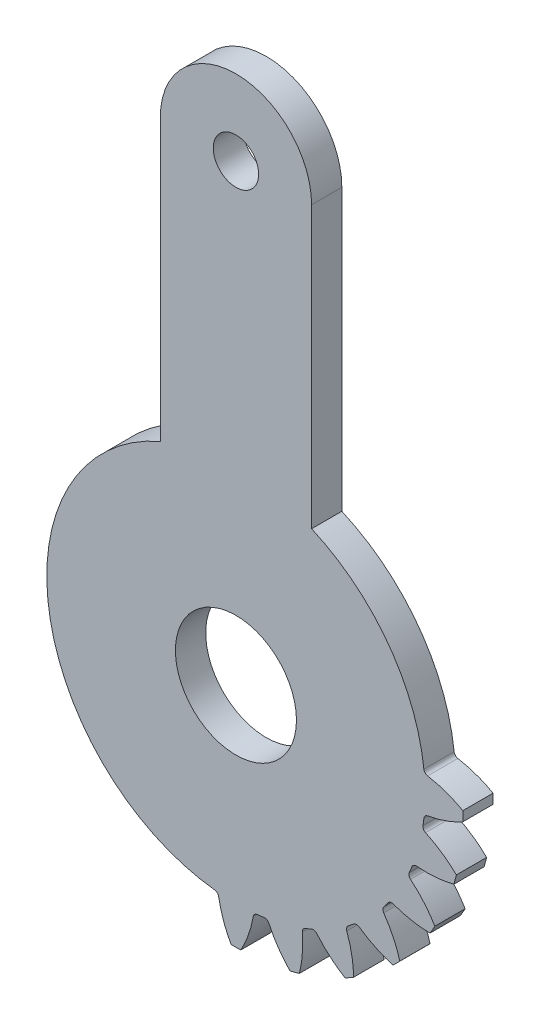
from build123d import *

# Parameters (mm, degrees)
SKETCH_1_R                       = 1.5
SKETCH_1_R_2                     = 4
EXTRUDE_2_DEPTH                  = 2
EXTRUDE_3_DEPTH                  = 2
FILLET_1_R                       = 0.3
PATTERN_CIRCULAR_1_COUNT         = 7
PATTERN_CIRCULAR_1_ANGLE         = 90
FILLET_1_OF_PATTERN_CIRCULAR_1_R = 0.3


with BuildPart() as part:
    # 스케치1 → 보스-돌출2 (new body)
    # profile 1 of 2: a face of its own
    with BuildSketch(Plane.XY):
        with BuildLine():
            ThreePointArc((5, 30), (0, 35), (-5, 30))
            Line((-5, 30), (-5, 16.248076809))
            ThreePointArc((-5, 16.248076809), (0, 17), (5, 16.248076809))
            Line((5, 16.248076809), (5, 30))
        make_face()
        with Locations((0, 30)):
            Circle(SKETCH_1_R, mode=Mode.SUBTRACT)
    # profile 2 of 2: a face of its own
    with BuildSketch(Plane.XY):
        with BuildLine():
            ThreePointArc((5, 16.248076809), (0, 17), (-5, 16.248076809))
            Line((-5, 16.248076809), (-5, 11.456439237))
            ThreePointArc((-5, 11.456439237), (-12.406213217, -1.528356511), (-2.07, -12.327412543))
            ThreePointArc((-2.07, -12.327412543), (0, -12.5), (2.07, -12.327412543))
            ThreePointArc((2.07, -12.327412543), (12.406213217, -1.528356511), (5, 11.456439237))
            Line((5, 11.456439237), (5, 16.248076809))
        make_face()
        Circle(SKETCH_1_R_2, mode=Mode.SUBTRACT)
    extrude(amount=EXTRUDE_2_DEPTH)

    # 스케치2 → 보스-돌출3 (add)
    with BuildSketch(Plane.XY):
        with BuildLine():
            add(Edge.make_bspline(
                [(-1.18, -12.444179362), (-0.984776615, -13.798777988), (-0.32, -14.996586278)],
                knots=[0, 0, 0, 1, 1, 1], degree=2))
            ThreePointArc((-0.32, -14.996586278), (0, -15), (0.32, -14.996586278))
            add(Edge.make_bspline(
                [(1.18, -12.444179362), (0.984776615, -13.798777988), (0.32, -14.996586278)],
                knots=[0, 0, 0, 1, 1, 1], degree=2))
            ThreePointArc((1.18, -12.444179362), (0, -12.5), (-1.18, -12.444179362))
        make_face()
    extrude_3 = extrude(amount=EXTRUDE_3_DEPTH)

    # 필렛1
    fillet_1_edges = [part.edges().sort_by_distance(p)[0] for p in [
        (-1.18, -12.444179362, 1),
        (1.18, -12.444179362, 1),
    ]]
    fillet(fillet_1_edges, radius=FILLET_1_R)

    # 원형 패턴1: 보스-돌출3 ×7 about axis
    pattern_circular_1_axis = Axis((0, 0, 0), (0, 0, 1))
    for i in range(1, PATTERN_CIRCULAR_1_COUNT):
        add(extrude_3.rotate(pattern_circular_1_axis, i * PATTERN_CIRCULAR_1_ANGLE / (PATTERN_CIRCULAR_1_COUNT - 1)))

    # 필렛1 of 원형 패턴1
    fillet_1_of_pattern_circular_1_edges = [part.edges().sort_by_distance(p)[0] for p in [
        (2.080998145, -12.325560706, 1),
        (4.360583095, -11.71474776, 1),
        (5.200179705, -11.366975457, 1),
        (7.243999658, -10.186975457, 1),
        (7.964977612, -9.633749615, 1),
        (9.633749615, -7.964977612, 1),
        (10.186975457, -7.243999658, 1),
        (11.366975457, -5.200179705, 1),
        (11.71474776, -4.360583095, 1),
        (12.325560706, -2.080998145, 1),
        (12.444179362, -1.18, 1),
        (12.444179362, 1.18, 1),
    ]]
    fillet(fillet_1_of_pattern_circular_1_edges, radius=FILLET_1_OF_PATTERN_CIRCULAR_1_R)


solid = part.part
